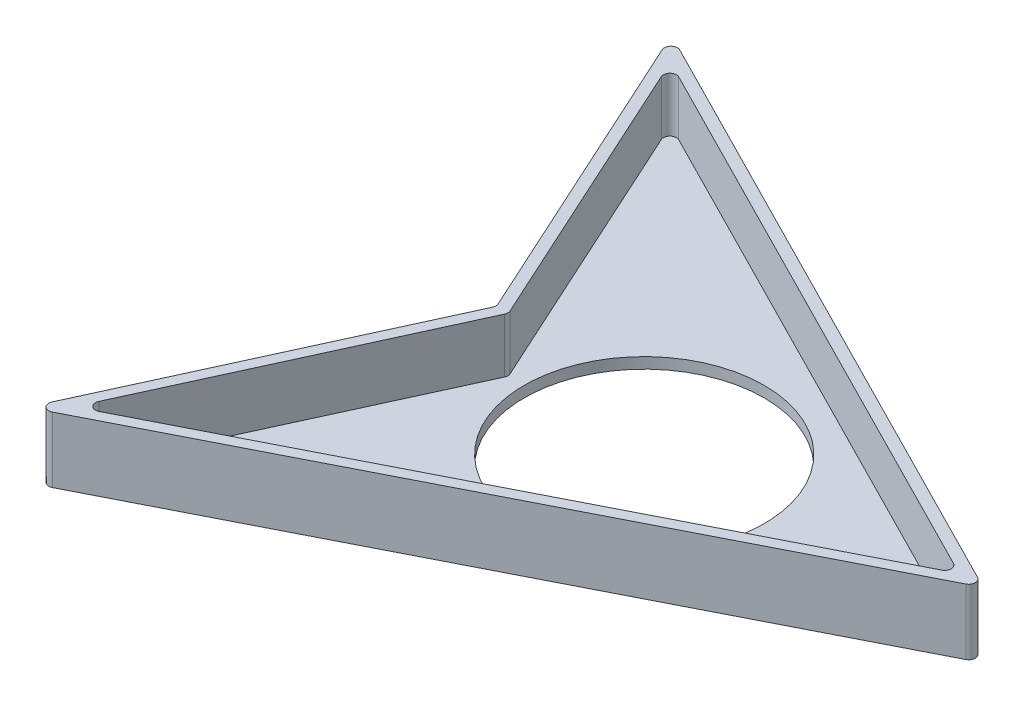
from build123d import *

# Parameters (mm, degrees)
SALIENTE_EXTRUIR1_DEPTH = 2.5
VACIADO1_T              = 0.5
CROQUIS3_R              = 5.5
CORTAR_EXTRUIR1_DEPTH   = 27.241879304
REDONDEO1_R             = 0.3


with BuildPart() as part:
    # Croquis2 → Saliente-Extruir1 (new body)
    with BuildSketch(Plane(origin=(0, 0, 0), x_dir=(1, 0, 0), z_dir=(0, 1, 0))):
        Polygon((-6.46994338, 13.677119477), (-0.219892949, 0), (-6.46994338, -13.677119477), (20.44143079, 0), align=None)
    extrude(amount=SALIENTE_EXTRUIR1_DEPTH)

    # Vaciado1
    vaciado1_openings = [part.faces().sort_by_distance(p)[0] for p in [
        (4.58386482, 2.5, 0),
    ]]
    offset(amount=VACIADO1_T, openings=vaciado1_openings, kind=Kind.INTERSECTION)

    # Croquis3 → Cortar-Extruir1 (cut, through all)
    with BuildSketch(Plane(origin=(0, 0, 0), x_dir=(1, 0, 0), z_dir=(0, 1, 0))):
        with Locations(Location((6, 0, 0), (0, 0, 270))):
            Circle(CROQUIS3_R)
    extrude(amount=-CORTAR_EXTRUIR1_DEPTH, mode=Mode.SUBTRACT)

    # Redondeo1
    redondeo1_edges = [part.edges().sort_by_distance(p)[0] for p in [
        (20.44143079, 1.25, 0),
        (-6.46994338, 1.25, -13.677119477),
        (-0.219892949, 1.25, 0),
        (-6.46994338, 1.25, 13.677119477),
        (21.545007766, 1, 0),
        (-7.519801831, 1, 14.771556106),
        (-0.769625322, 1, 0),
        (-7.519801831, 1, -14.771556106),
    ]]
    fillet(redondeo1_edges, radius=REDONDEO1_R)


solid = part.part
